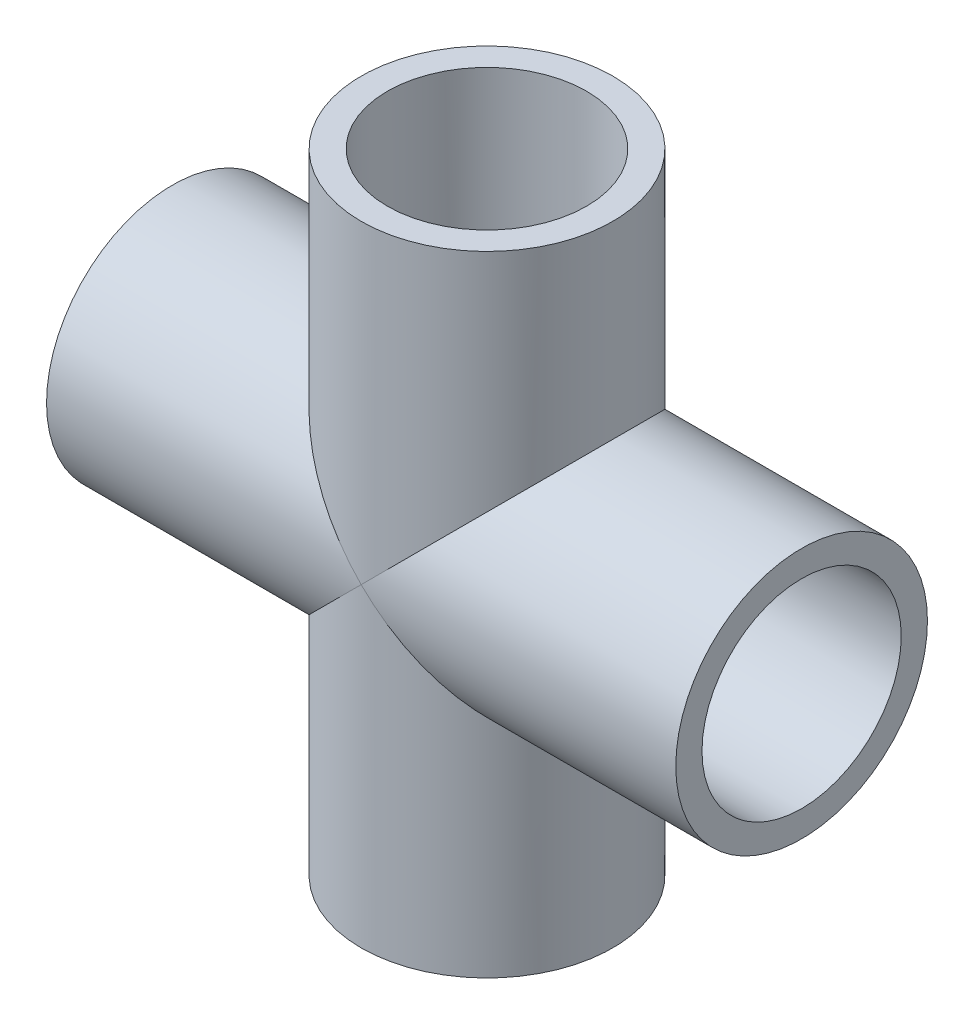
from build123d import *

# Parameters (mm, degrees)
SKETCH1_R                = 30.48
SKETCH1_R_2              = 24.13
BOSS_EXTRUDE1_DEPTH      = 152.4
BOSS_EXTRUDE2_DEPTH      = 76.2
BOSS_EXTRUDE2_DEPTH_BACK = 76.2
SKETCH2_R                = 30.48
SKETCH2_R_2              = 24.13
SKETCH4_R                = 3.175
CUT_EXTRUDE1_DEPTH       = 174.093126512


with BuildPart() as part:
    # Sketch1 → Boss-Extrude1 (new body)
    with BuildSketch(Plane(origin=(0, 0, 0), x_dir=(0, 0, -1), z_dir=(1, 0, 0))):
        Circle(SKETCH1_R)
        Circle(SKETCH1_R_2, mode=Mode.SUBTRACT)
    extrude(amount=BOSS_EXTRUDE1_DEPTH)

    # Sketch2 → Boss-Extrude2 (add, two sides: drawn at the far end of the back side and taken through both)
    with BuildSketch(Plane(origin=(0, 0, 0), x_dir=(1, 0, 0), z_dir=(0, 1, 0)).offset(-BOSS_EXTRUDE2_DEPTH_BACK)):
        with Locations((76.2, 0)):
            Circle(SKETCH2_R)
        with Locations((76.2, 0)):
            Circle(SKETCH2_R_2, mode=Mode.SUBTRACT)
    extrude(amount=BOSS_EXTRUDE2_DEPTH + BOSS_EXTRUDE2_DEPTH_BACK)

    # Sketch4 → Cut-Extrude1 (cut, through all)
    with BuildSketch(Plane.XY):
        with Locations((76.2, 0)):
            Circle(SKETCH4_R)
    extrude(amount=-CUT_EXTRUDE1_DEPTH, mode=Mode.SUBTRACT)


solid = part.part
